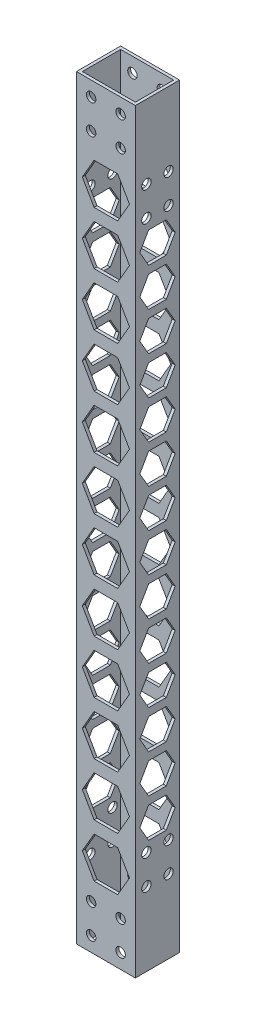
from build123d import *

# Parameters (mm, degrees)
SKETCH_1_W          = 20
SKETCH_1_H          = 15
SKETCH_1_W_2        = 18
SKETCH_1_H_2        = 13
EXTRUDE_1_DEPTH     = 256.4
SKETCH_2_R          = 1.6
CUT_EXTRUDE_1_DEPTH = 258.615915657
SKETCH_3_R          = 1.6
CUT_EXTRUDE_2_DEPTH = 258.615915657


with BuildPart() as part:
    # 草图1 → 凸台-拉伸1 (new body)
    with BuildSketch(Plane(origin=(0, 0, 0), x_dir=(1, 0, 0), z_dir=(0, 1, 0))):
        with Locations((10, -7.5)):
            Rectangle(SKETCH_1_W, SKETCH_1_H)
        with Locations((10, -7.5)):
            Rectangle(SKETCH_1_W_2, SKETCH_1_H_2, mode=Mode.SUBTRACT)
    extrude(amount=EXTRUDE_1_DEPTH)

    # 草图2 → 切除-拉伸1 (cut, through all)
    with BuildSketch(Plane.XY.offset(15)):
        with Locations((5, 5)):
            Circle(SKETCH_2_R)
        with Locations((15, 5)):
            Circle(SKETCH_2_R)
        with Locations((15, 15)):
            Circle(SKETCH_2_R)
        with Locations((5, 15)):
            Circle(SKETCH_2_R)
        with Locations((5, 241.4)):
            Circle(SKETCH_2_R)
        with Locations((15, 241.4)):
            Circle(SKETCH_2_R)
        with Locations((15, 251.4)):
            Circle(SKETCH_2_R)
        with Locations((5, 251.4)):
            Circle(SKETCH_2_R)
        Polygon((14, 233.32820323), (6, 233.32820323), (2, 226.4), (6, 219.47179677), (14, 219.47179677), (18, 226.4), align=None)
        Polygon((18, 208.4), (14, 215.32820323), (6, 215.32820323), (2, 208.4), (6, 201.47179677), (14, 201.47179677), align=None)
        Polygon((18, 190.4), (14, 197.32820323), (6, 197.32820323), (2, 190.4), (6, 183.47179677), (14, 183.47179677), align=None)
        Polygon((18, 172.4), (14, 179.32820323), (6, 179.32820323), (2, 172.4), (6, 165.47179677), (14, 165.47179677), align=None)
        Polygon((18, 154.4), (14, 161.32820323), (6, 161.32820323), (2, 154.4), (6, 147.47179677), (14, 147.47179677), align=None)
        Polygon((18, 136.4), (14, 143.32820323), (6, 143.32820323), (2, 136.4), (6, 129.47179677), (14, 129.47179677), align=None)
        Polygon((18, 118.4), (14, 125.32820323), (6, 125.32820323), (2, 118.4), (6, 111.47179677), (14, 111.47179677), align=None)
        Polygon((18, 100.4), (14, 107.32820323), (6, 107.32820323), (2, 100.4), (6, 93.47179677), (14, 93.47179677), align=None)
        Polygon((18, 82.4), (14, 89.32820323), (6, 89.32820323), (2, 82.4), (6, 75.47179677), (14, 75.47179677), align=None)
        Polygon((18, 64.4), (14, 71.32820323), (6, 71.32820323), (2, 64.4), (6, 57.47179677), (14, 57.47179677), align=None)
        Polygon((18, 46.4), (14, 53.32820323), (6, 53.32820323), (2, 46.4), (6, 39.47179677), (14, 39.47179677), align=None)
        Polygon((18, 28.4), (14, 35.32820323), (6, 35.32820323), (2, 28.4), (6, 21.47179677), (14, 21.47179677), align=None)
    extrude(amount=-CUT_EXTRUDE_1_DEPTH, mode=Mode.SUBTRACT)

    # 草图3 → 切除-拉伸2 (cut, through all)
    with BuildSketch(Plane(origin=(20, 0, 0), x_dir=(0, 0, -1), z_dir=(1, 0, 0))):
        with Locations((-11.25, 231.4)):
            Circle(SKETCH_3_R)
        with Locations(Location((-3.75, 231.4, 0), (0, 0, 180))):
            Circle(SKETCH_3_R)
        with Locations((-3.75, 221.4)):
            Circle(SKETCH_3_R)
        with Locations(Location((-11.25, 221.4, 0), (0, 0, 180))):
            Circle(SKETCH_3_R)
        with Locations((-11.25, 35)):
            Circle(SKETCH_3_R)
        with Locations(Location((-3.75, 35, 0), (0, 0, 180))):
            Circle(SKETCH_3_R)
        with Locations((-3.75, 25)):
            Circle(SKETCH_3_R)
        with Locations(Location((-11.25, 25, 0), (0, 0, 180))):
            Circle(SKETCH_3_R)
        Polygon((-4.5, 217.596152423), (-10.5, 217.596152423), (-13.5, 212.4), (-10.5, 207.203847577), (-4.5, 207.203847577), (-1.5, 212.4), align=None)
        Polygon((-4.5, 204.596152423), (-10.5, 204.596152423), (-13.5, 199.4), (-10.5, 194.203847577), (-4.5, 194.203847577), (-1.5, 199.4), align=None)
        Polygon((-4.5, 191.596152423), (-10.5, 191.596152423), (-13.5, 186.4), (-10.5, 181.203847577), (-4.5, 181.203847577), (-1.5, 186.4), align=None)
        Polygon((-4.5, 178.596152423), (-10.5, 178.596152423), (-13.5, 173.4), (-10.5, 168.203847577), (-4.5, 168.203847577), (-1.5, 173.4), align=None)
        Polygon((-4.5, 165.596152423), (-10.5, 165.596152423), (-13.5, 160.4), (-10.5, 155.203847577), (-4.5, 155.203847577), (-1.5, 160.4), align=None)
        Polygon((-4.5, 152.596152423), (-10.5, 152.596152423), (-13.5, 147.4), (-10.5, 142.203847577), (-4.5, 142.203847577), (-1.5, 147.4), align=None)
        Polygon((-4.5, 139.596152423), (-10.5, 139.596152423), (-13.5, 134.4), (-10.5, 129.203847577), (-4.5, 129.203847577), (-1.5, 134.4), align=None)
        Polygon((-4.5, 126.596152423), (-10.5, 126.596152423), (-13.5, 121.4), (-10.5, 116.203847577), (-4.5, 116.203847577), (-1.5, 121.4), align=None)
        Polygon((-4.5, 113.596152423), (-10.5, 113.596152423), (-13.5, 108.4), (-10.5, 103.203847577), (-4.5, 103.203847577), (-1.5, 108.4), align=None)
        Polygon((-4.5, 100.596152423), (-10.5, 100.596152423), (-13.5, 95.4), (-10.5, 90.203847577), (-4.5, 90.203847577), (-1.5, 95.4), align=None)
        Polygon((-4.5, 87.596152423), (-10.5, 87.596152423), (-13.5, 82.4), (-10.5, 77.203847577), (-4.5, 77.203847577), (-1.5, 82.4), align=None)
        Polygon((-4.5, 74.596152423), (-10.5, 74.596152423), (-13.5, 69.4), (-10.5, 64.203847577), (-4.5, 64.203847577), (-1.5, 69.4), align=None)
        Polygon((-4.5, 61.596152423), (-10.5, 61.596152423), (-13.5, 56.4), (-10.5, 51.203847577), (-4.5, 51.203847577), (-1.5, 56.4), align=None)
        Polygon((-4.5, 48.596152423), (-10.5, 48.596152423), (-13.5, 43.4), (-10.5, 38.203847577), (-4.5, 38.203847577), (-1.5, 43.4), align=None)
    extrude(amount=-CUT_EXTRUDE_2_DEPTH, mode=Mode.SUBTRACT)


solid = part.part
